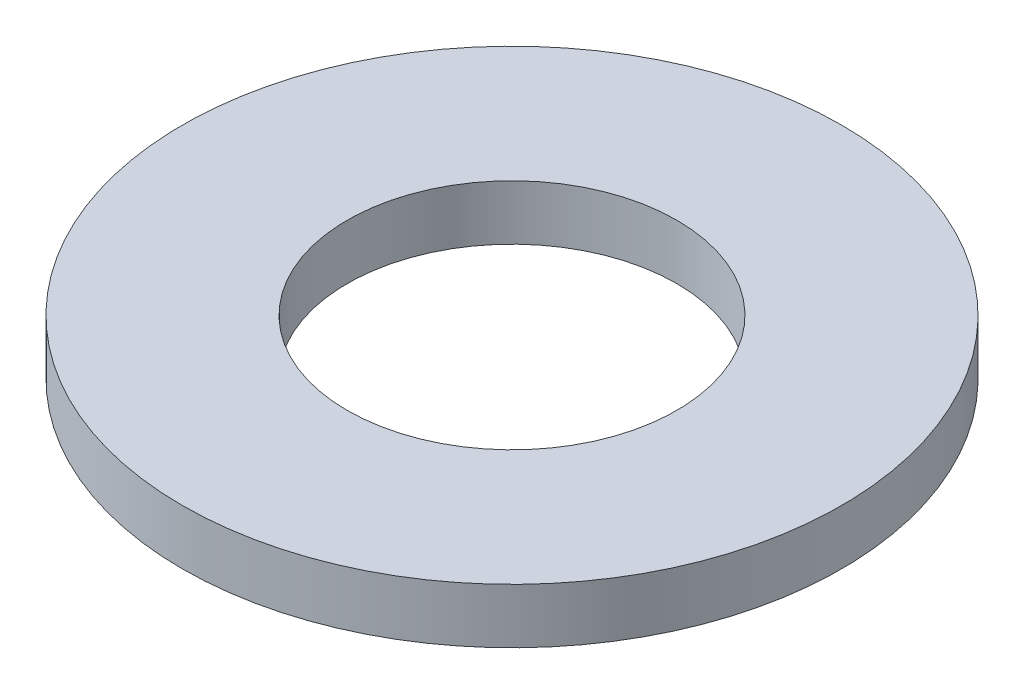
from build123d import *

# Parameters (mm, degrees)
SKETCH1_R           = 19.05
SKETCH1_R_2         = 9.525
BOSS_EXTRUDE1_DEPTH = 3.175


with BuildPart() as part:
    # Sketch1 → Boss-Extrude1 (new body)
    with BuildSketch(Plane(origin=(0, 0, 0), x_dir=(1, 0, 0), z_dir=(0, 1, 0))):
        with Locations(Location((0, 0, 0), (0, 0, 270))):
            Circle(SKETCH1_R)
        with Locations(Location((0, 0, 0), (0, 0, 270))):
            Circle(SKETCH1_R_2, mode=Mode.SUBTRACT)
    extrude(amount=BOSS_EXTRUDE1_DEPTH)


solid = part.part
